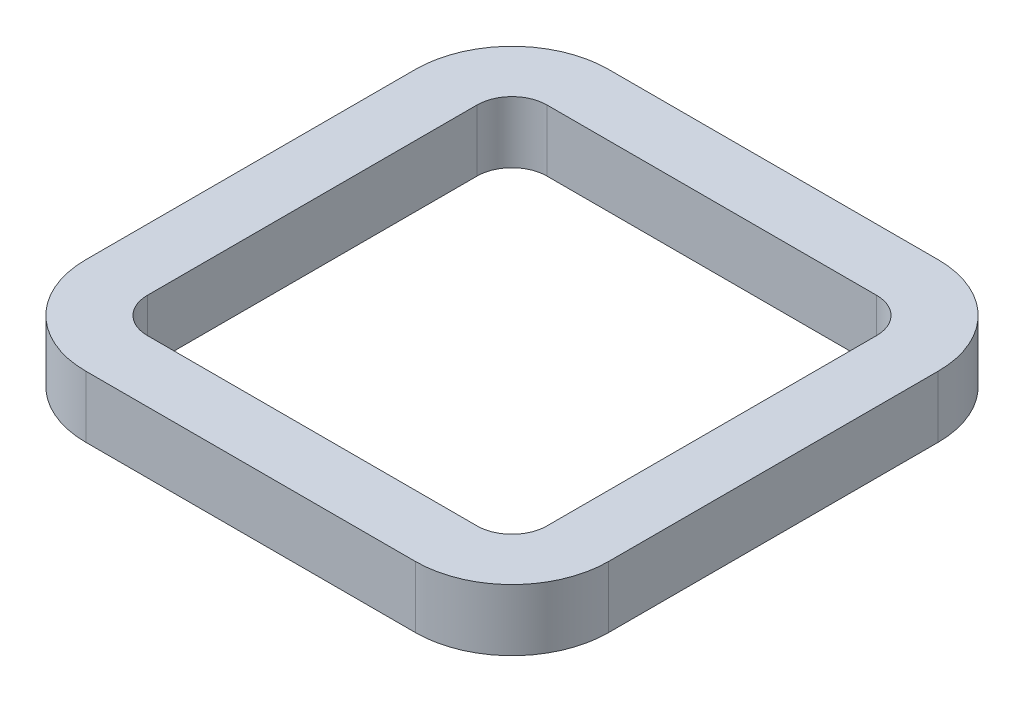
from build123d import *

# Parameters (mm, degrees)
BOSS_EXTRUDE1_DEPTH = 3


with BuildPart() as part:
    # Sketch1 → Boss-Extrude1 (new body)
    with BuildSketch(Plane(origin=(0, 0, 0), x_dir=(1, 0, 0), z_dir=(0, 1, 0))):
        with BuildLine():
            Line((-12.725, 8.025), (-12.725, -8.025))
            ThreePointArc((-12.725, -8.025), (-11.348401872, -11.348401872), (-8.025, -12.725))
            Line((-8.025, -12.725), (8.025, -12.725))
            ThreePointArc((8.025, -12.725), (11.348401872, -11.348401872), (12.725, -8.025))
            Line((12.725, -8.025), (12.725, 8.025))
            ThreePointArc((12.725, 8.025), (11.348401872, 11.348401872), (8.025, 12.725))
            Line((8.025, 12.725), (-8.025, 12.725))
            ThreePointArc((-8.025, 12.725), (-11.348401872, 11.348401872), (-12.725, 8.025))
        make_face()
        with BuildLine():
            Line((-9.725, 8.025), (-9.725, -8.025))
            ThreePointArc((-9.725, -8.025), (-9.227081528, -9.227081528), (-8.025, -9.725))
            Line((-8.025, -9.725), (8.025, -9.725))
            ThreePointArc((8.025, -9.725), (9.227081528, -9.227081528), (9.725, -8.025))
            Line((9.725, -8.025), (9.725, 8.025))
            ThreePointArc((9.725, 8.025), (9.227081528, 9.227081528), (8.025, 9.725))
            Line((8.025, 9.725), (-8.025, 9.725))
            ThreePointArc((-8.025, 9.725), (-9.227081528, 9.227081528), (-9.725, 8.025))
        make_face(mode=Mode.SUBTRACT)
    extrude(amount=BOSS_EXTRUDE1_DEPTH)


solid = part.part
